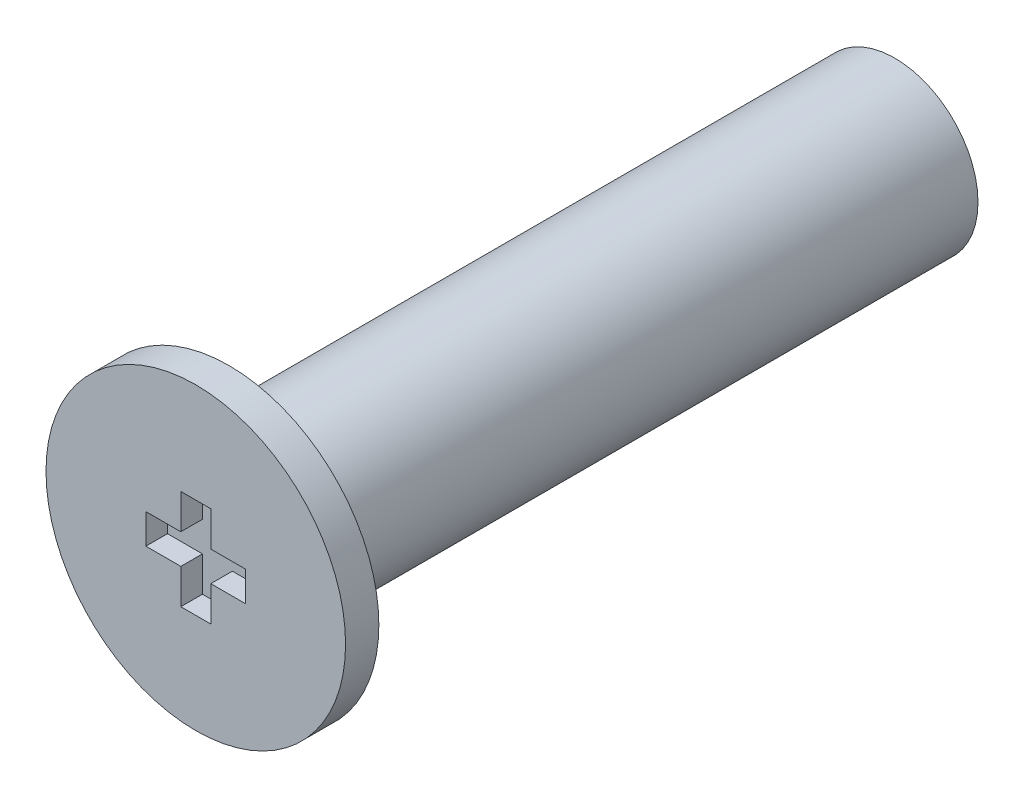
from build123d import *

# Parameters (mm, degrees)
SKETCH_1_R        = 2.5
EXTRUDE_198_DEPTH = 20
SKETCH_6_W        = 4.5
SKETCH_6_H        = 1
PH2_START         = 1.01
PH2_DEPTH         = 0.66


with BuildPart() as part:
    # 草图1 → Extrude 198 (new body)
    with BuildSketch(Plane.XY):
        Circle(SKETCH_1_R)
    extrude(amount=-EXTRUDE_198_DEPTH)

    # 草图6 → Revolve 324 (revolve)
    with BuildSketch(Plane(origin=(0, 0, 0), x_dir=(1, 0, 0), z_dir=(0, 1, 0)), mode=Mode.PRIVATE) as revolve_324_sk:
        with Locations((2.25, -0.5)):
            Rectangle(SKETCH_6_W, SKETCH_6_H)
    revolve(revolve_324_sk.sketch.rotate(Axis((0, 0, -2), (0, 0, 1)), 180), axis=Axis((0, 0, -2), (0, 0, 1)))

    # 草图7 → 十字槽_PH2_简化 (cut)
    with BuildSketch(Plane.XY.offset(PH2_START)):
        Polygon((-0.45, -1.5), (0.45, -1.5), (0.45, -0.45), (1.5, -0.45), (1.5, 0.45), (0.45, 0.45), (0.45, 1.5), (-0.45, 1.5), (-0.45, 0.45), (-1.5, 0.45), (-1.5, -0.45), (-0.45, -0.45), align=None)
    extrude(amount=-PH2_DEPTH, mode=Mode.SUBTRACT)


solid = part.part
